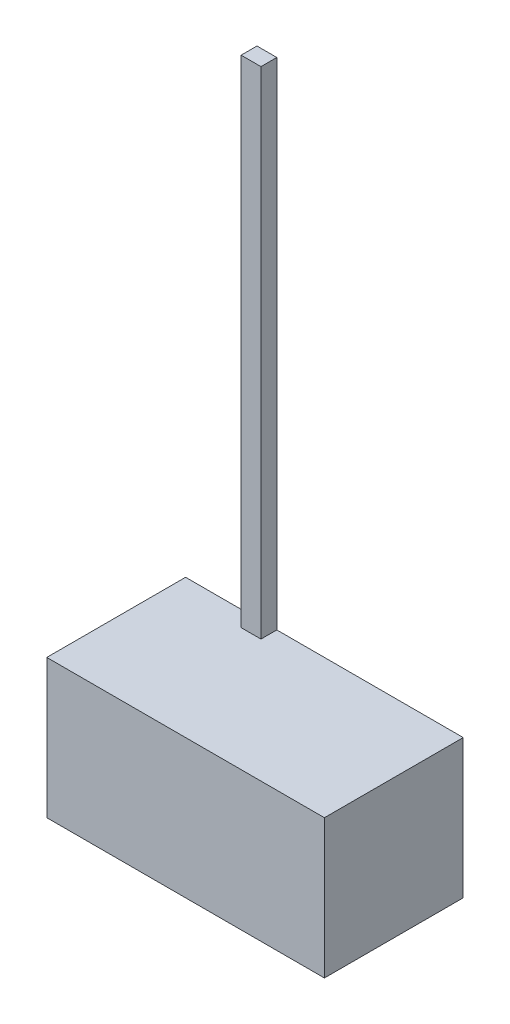
from build123d import *

# Parameters (mm, degrees)
SKETCH1_W           = 50
SKETCH1_H           = 1250
BOSS_EXTRUDE1_DEPTH = 40
SKETCH2_W           = 700
SKETCH2_H           = 350
BOSS_EXTRUDE2_DEPTH = 350


with BuildPart() as part:
    # Sketch1 → Boss-Extrude1 (new body)
    with BuildSketch(Plane.XY):
        with Locations((1805, -825)):
            Rectangle(SKETCH1_W, SKETCH1_H)
    extrude(amount=BOSS_EXTRUDE1_DEPTH)


with BuildPart() as body_2:
    # Sketch2 → Boss-Extrude2 (new body)
    with BuildSketch(Plane.XY):
        with Locations((1950, -1625)):
            Rectangle(SKETCH2_W, SKETCH2_H)
    extrude(amount=BOSS_EXTRUDE2_DEPTH)


solid = Compound([part.part, body_2.part])
